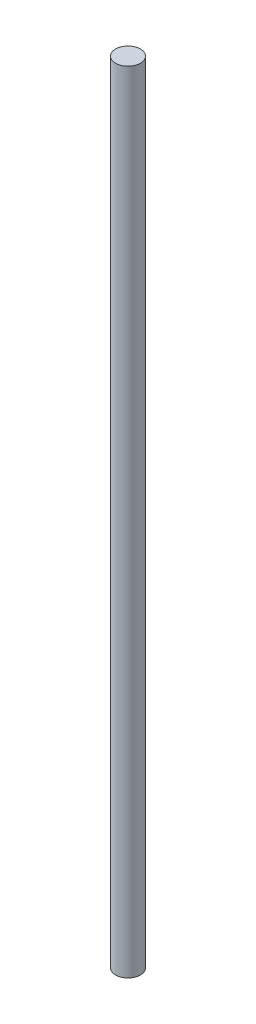
from build123d import *

# Parameters (mm, degrees)
CROQUIS1_R              = 4
SALIENTE_EXTRUIR1_DEPTH = 255


with BuildPart() as part:
    # Croquis1 → Saliente-Extruir1 (new body)
    with BuildSketch(Plane(origin=(0, 0, 0), x_dir=(1, 0, 0), z_dir=(0, 1, 0))):
        with Locations(Location((0, 0, 0), (0, 0, 270))):
            Circle(CROQUIS1_R)
    extrude(amount=SALIENTE_EXTRUIR1_DEPTH)


solid = part.part
